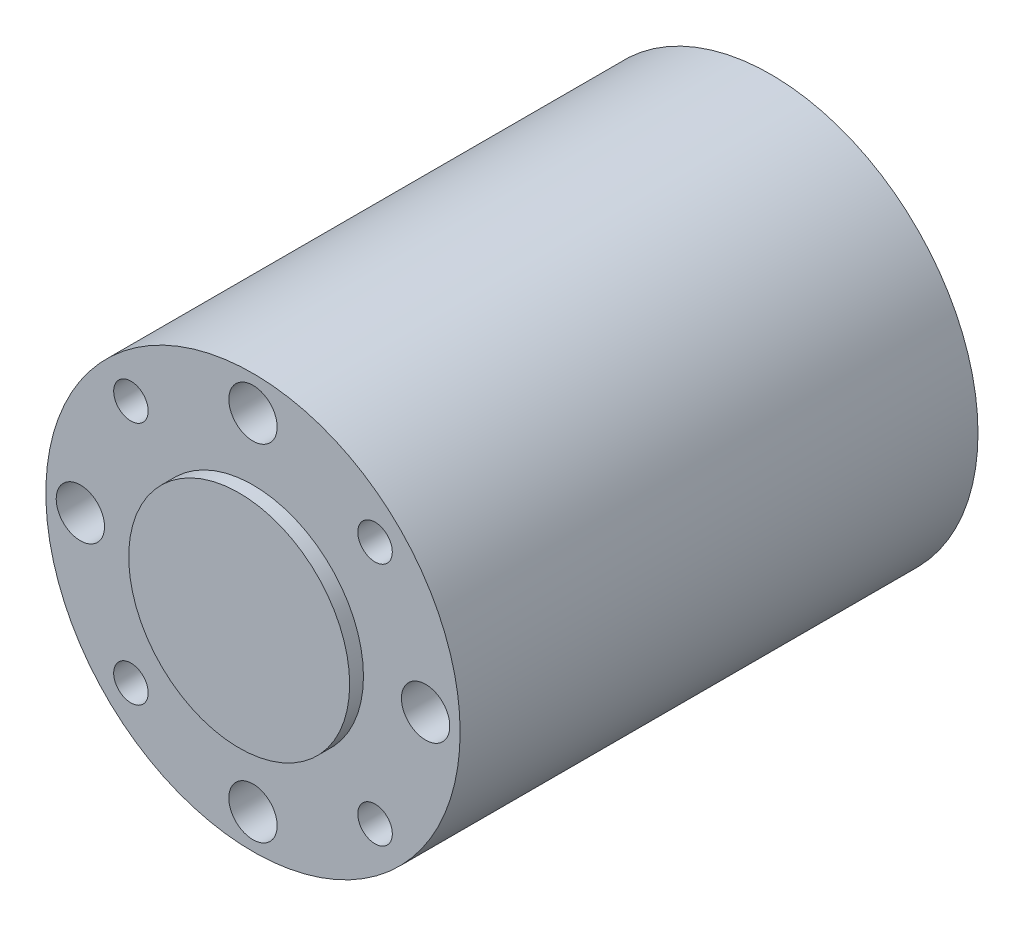
from build123d import *

# Parameters (mm, degrees)
SKETCH1_R           = 30
BOSS_EXTRUDE1_DEPTH = 75
SKETCH2_R           = 3.5
SKETCH2_R_2         = 2.5
CUT_EXTRUDE1_DEPTH  = 10
SKETCH3_R           = 16
BOSS_EXTRUDE2_DEPTH = 2


with BuildPart() as part:
    # Sketch1 → Boss-Extrude1 (new body)
    with BuildSketch(Plane.XY):
        Circle(SKETCH1_R)
    extrude(amount=BOSS_EXTRUDE1_DEPTH)

    # Sketch2 → Cut-Extrude1 (cut)
    with BuildSketch(Plane.XY.offset(75)):
        with Locations((0, 25)):
            Circle(SKETCH2_R)
        with Locations((17.67766953, 17.67766953)):
            Circle(SKETCH2_R_2)
        with Locations(Location((-17.67766953, 17.67766953, 0), (0, 0, 180))):
            Circle(SKETCH2_R_2)
        with Locations(Location((17.67766953, -17.67766953, 0), (0, 0, 180))):
            Circle(SKETCH2_R_2)
        with Locations((-17.67766953, -17.67766953)):
            Circle(SKETCH2_R_2)
        with Locations(Location((25, 0, 0), (0, 0, 180))):
            Circle(SKETCH2_R)
        with Locations(Location((-25, 0, 0), (0, 0, 180))):
            Circle(SKETCH2_R)
        with Locations((0, -25)):
            Circle(SKETCH2_R)
    extrude(amount=-CUT_EXTRUDE1_DEPTH, mode=Mode.SUBTRACT)

    # Sketch3 → Boss-Extrude2 (add)
    with BuildSketch(Plane.XY.offset(75)):
        Circle(SKETCH3_R)
    extrude(amount=BOSS_EXTRUDE2_DEPTH)


solid = part.part
